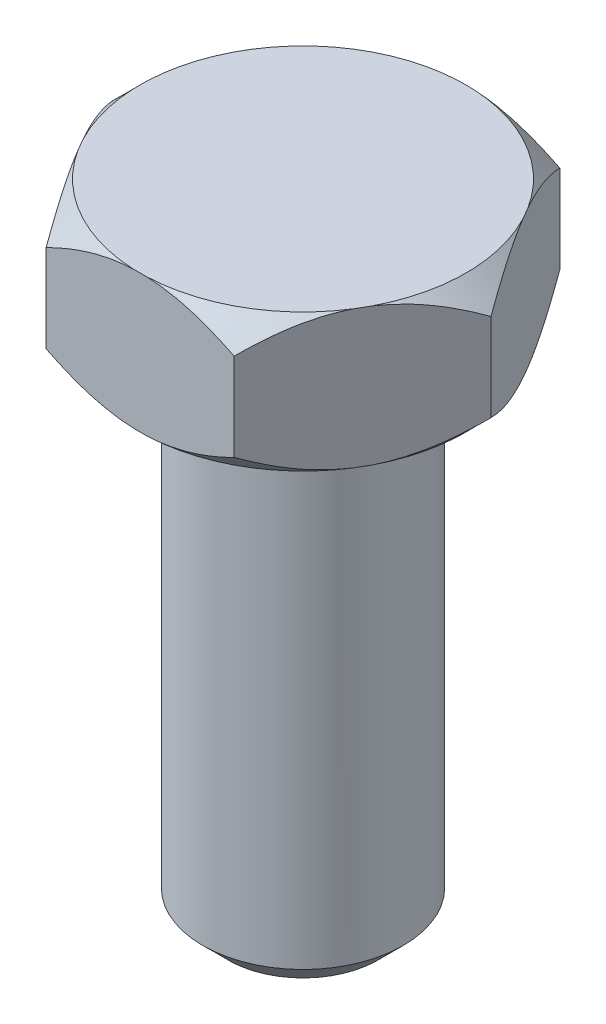
from build123d import *

# Parameters (mm, degrees)
EXTRUDE_1_DEPTH = 5.5
SKETCH_5_R      = 4
EXTRUDE_2_DEPTH = 20
CHAMFER_1_SIZE  = 1


with BuildPart() as part:
    # Эскиз1 → Вытянуть1 (new body)
    with BuildSketch(Plane(origin=(0, 0, 0), x_dir=(1, 0, 0), z_dir=(0, 1, 0))):
        Polygon((-3.75277675, 6.5), (3.75277675, 6.5), (7.505553499, 0), (3.75277675, -6.5), (-3.75277675, -6.5), (-7.505553499, 0), align=None)
    extrude(amount=-EXTRUDE_1_DEPTH)

    # Эскиз5 → Вытянуть2 (add)
    with BuildSketch(Plane.XZ.offset(5.5)):
        with Locations(Location((0, 0, 0), (0, 0, 90))):
            Circle(SKETCH_5_R)
    extrude(amount=EXTRUDE_2_DEPTH)

    # Фаска1
    chamfer_1_edges = [part.edges().sort_by_distance(p)[0] for p in [
        (0, -25.5, -4),
    ]]
    chamfer(chamfer_1_edges, length=CHAMFER_1_SIZE)

    # Эскиз4 → Вырез-Повернуть1 (revolve, cut)
    with BuildSketch(Plane.XY, mode=Mode.PRIVATE) as cut_revolve_1_sk:
        Polygon((-7.505553499, -1), (-6.505553499, 0), (-7.505553499, 0), align=None)
        Polygon((-7.505553499, -4.5), (-6.505553499, -5.5), (-7.505553499, -5.5), align=None)
    revolve(cut_revolve_1_sk.sketch.rotate(Axis((0, -5.5, 0), (0, -1, 0)), 90), axis=Axis((0, -5.5, 0), (0, -1, 0)), mode=Mode.SUBTRACT)


solid = part.part
